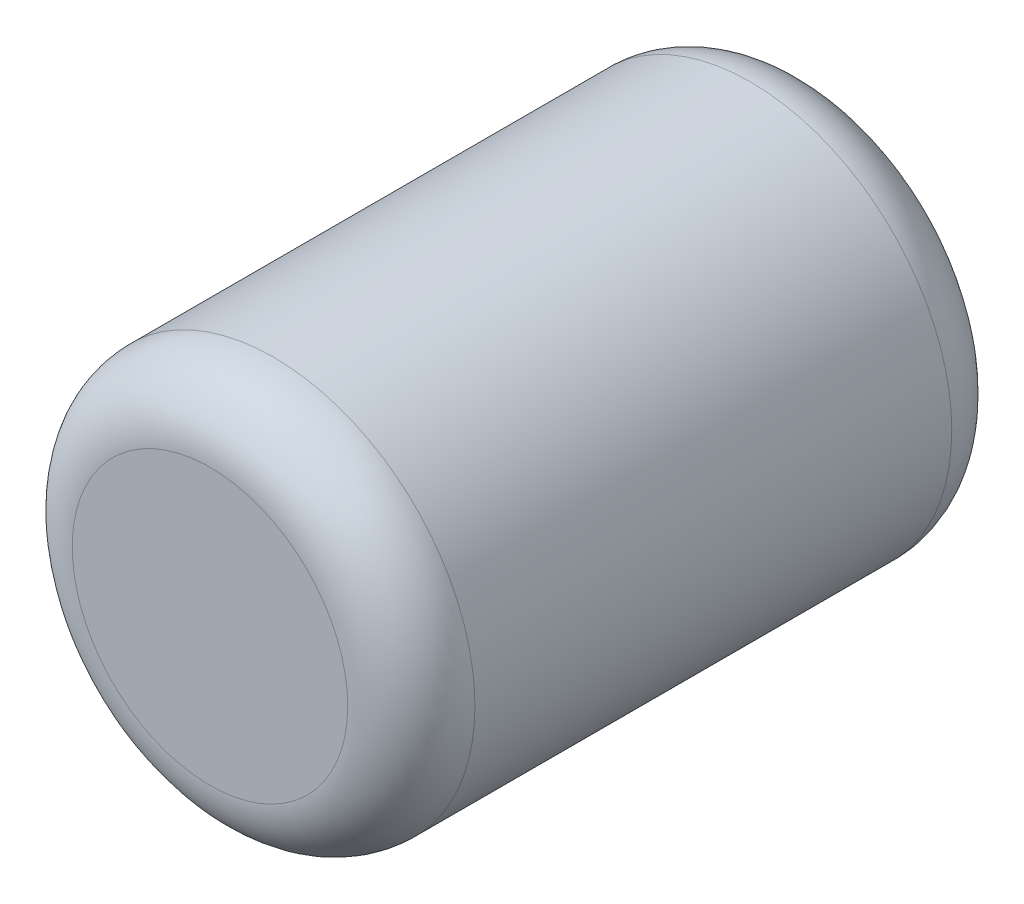
from build123d import *

# Parameters (mm, degrees)
SKETCH2_R           = 9.5
BOSS_EXTRUDE1_DEPTH = 28.5
FILLET1_R           = 3


with BuildPart() as part:
    # Sketch2 → Boss-Extrude1 (new body)
    with BuildSketch(Plane.XY):
        with Locations(Location((0, 0, 0), (0, 0, 180))):
            Circle(SKETCH2_R)
    extrude(amount=BOSS_EXTRUDE1_DEPTH)

    # Fillet1
    fillet1_edges = [part.edges().sort_by_distance(p)[0] for p in [
        (9.5, 0, 0),
        (9.5, 0, 28.5),
    ]]
    fillet(fillet1_edges, radius=FILLET1_R)


solid = part.part
